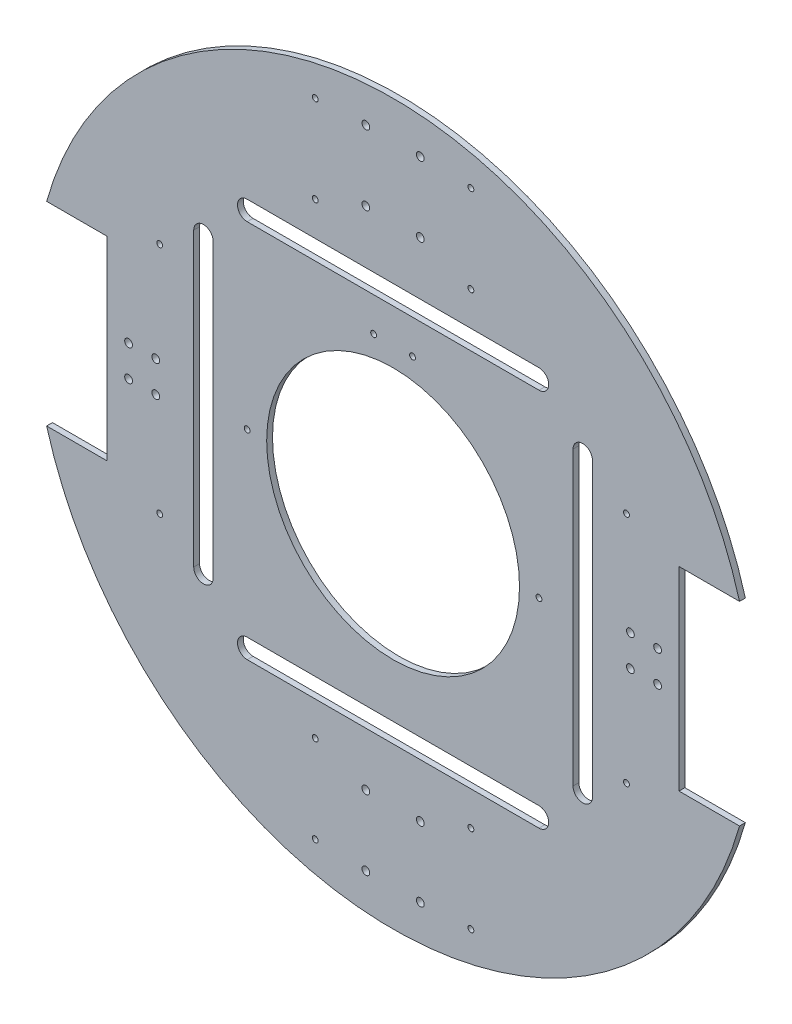
from build123d import *

# Parameters (mm, degrees)
SKETCH_1_R      = 2
SKETCH_1_R_2    = 1.5
SKETCH_1_R_3    = 65
EXTRUDE_5_DEPTH = 3


with BuildPart() as part:
    # 草图1 → 凸台-拉伸5 (new body)
    with BuildSketch(Plane.XY):
        with BuildLine():
            Line((147, 50), (178.115131306, 50))
            ThreePointArc((178.115131306, 50), (0, 185), (-178.115131306, 50))
            Line((-178.115131306, 50), (-147, 50))
            Line((-147, 50), (-147, -50))
            Line((-147, -50), (-178.115131306, -50))
            ThreePointArc((-178.115131306, -50), (0, -185), (178.115131306, -50))
            Line((178.115131306, -50), (147, -50))
            Line((147, -50), (147, 50))
        make_face()
        with Locations((-136, 8)):
            Circle(SKETCH_1_R, mode=Mode.SUBTRACT)
        with Locations((-122, 8)):
            Circle(SKETCH_1_R, mode=Mode.SUBTRACT)
        with Locations((-122, -8)):
            Circle(SKETCH_1_R, mode=Mode.SUBTRACT)
        with Locations((-136, -8)):
            Circle(SKETCH_1_R, mode=Mode.SUBTRACT)
        with Locations((122, 8)):
            Circle(SKETCH_1_R, mode=Mode.SUBTRACT)
        with Locations((136, 8)):
            Circle(SKETCH_1_R, mode=Mode.SUBTRACT)
        with Locations((136, -8)):
            Circle(SKETCH_1_R, mode=Mode.SUBTRACT)
        with Locations((122, -8)):
            Circle(SKETCH_1_R, mode=Mode.SUBTRACT)
        with Locations((14, 166)):
            Circle(SKETCH_1_R, mode=Mode.SUBTRACT)
        with Locations((14, 130)):
            Circle(SKETCH_1_R, mode=Mode.SUBTRACT)
        with Locations((-14, 130)):
            Circle(SKETCH_1_R, mode=Mode.SUBTRACT)
        with Locations((-14, 166)):
            Circle(SKETCH_1_R, mode=Mode.SUBTRACT)
        with Locations((-14, -166)):
            Circle(SKETCH_1_R, mode=Mode.SUBTRACT)
        with Locations((-14, -130)):
            Circle(SKETCH_1_R, mode=Mode.SUBTRACT)
        with Locations((14, -130)):
            Circle(SKETCH_1_R, mode=Mode.SUBTRACT)
        with Locations((14, -166)):
            Circle(SKETCH_1_R, mode=Mode.SUBTRACT)
        with Locations((-40, 165)):
            Circle(SKETCH_1_R_2, mode=Mode.SUBTRACT)
        with Locations((40, 165)):
            Circle(SKETCH_1_R_2, mode=Mode.SUBTRACT)
        with Locations((40, -120)):
            Circle(SKETCH_1_R_2, mode=Mode.SUBTRACT)
        with Locations((-40, -120)):
            Circle(SKETCH_1_R_2, mode=Mode.SUBTRACT)
        with Locations((-40, 120)):
            Circle(SKETCH_1_R_2, mode=Mode.SUBTRACT)
        with Locations((40, 120)):
            Circle(SKETCH_1_R_2, mode=Mode.SUBTRACT)
        with Locations((-40, -165)):
            Circle(SKETCH_1_R_2, mode=Mode.SUBTRACT)
        with Locations((40, -165)):
            Circle(SKETCH_1_R_2, mode=Mode.SUBTRACT)
        with Locations((-120, 60)):
            Circle(SKETCH_1_R_2, mode=Mode.SUBTRACT)
        with Locations((-120, -60)):
            Circle(SKETCH_1_R_2, mode=Mode.SUBTRACT)
        with Locations((120, -60)):
            Circle(SKETCH_1_R_2, mode=Mode.SUBTRACT)
        with Locations((120, 60)):
            Circle(SKETCH_1_R_2, mode=Mode.SUBTRACT)
        Circle(SKETCH_1_R_3, mode=Mode.SUBTRACT)
        with Locations((-75, 0)):
            Circle(SKETCH_1_R_2, mode=Mode.SUBTRACT)
        with Locations((75, 0)):
            Circle(SKETCH_1_R_2, mode=Mode.SUBTRACT)
        with Locations((-10, 75)):
            Circle(SKETCH_1_R_2, mode=Mode.SUBTRACT)
        with Locations((10, 75)):
            Circle(SKETCH_1_R_2, mode=Mode.SUBTRACT)
        with BuildLine():
            Line((-75, -102.5), (75, -102.5))
            ThreePointArc((75, -102.5), (80, -97.5), (75, -92.5))
            Line((75, -92.5), (-75, -92.5))
            ThreePointArc((-75, -92.5), (-80, -97.5), (-75, -102.5))
        make_face(mode=Mode.SUBTRACT)
        with BuildLine():
            Line((-102.5, -75), (-102.5, 75))
            ThreePointArc((-102.5, 75), (-97.5, 80), (-92.5, 75))
            Line((-92.5, 75), (-92.5, -75))
            ThreePointArc((-92.5, -75), (-97.5, -80), (-102.5, -75))
        make_face(mode=Mode.SUBTRACT)
        with BuildLine():
            Line((102.5, -75), (102.5, 75))
            ThreePointArc((102.5, 75), (97.5, 80), (92.5, 75))
            Line((92.5, 75), (92.5, -75))
            ThreePointArc((92.5, -75), (97.5, -80), (102.5, -75))
        make_face(mode=Mode.SUBTRACT)
        with BuildLine():
            Line((-75, 102.5), (75, 102.5))
            ThreePointArc((75, 102.5), (80, 97.5), (75, 92.5))
            Line((75, 92.5), (-75, 92.5))
            ThreePointArc((-75, 92.5), (-80, 97.5), (-75, 102.5))
        make_face(mode=Mode.SUBTRACT)
    extrude(amount=EXTRUDE_5_DEPTH)


solid = part.part
